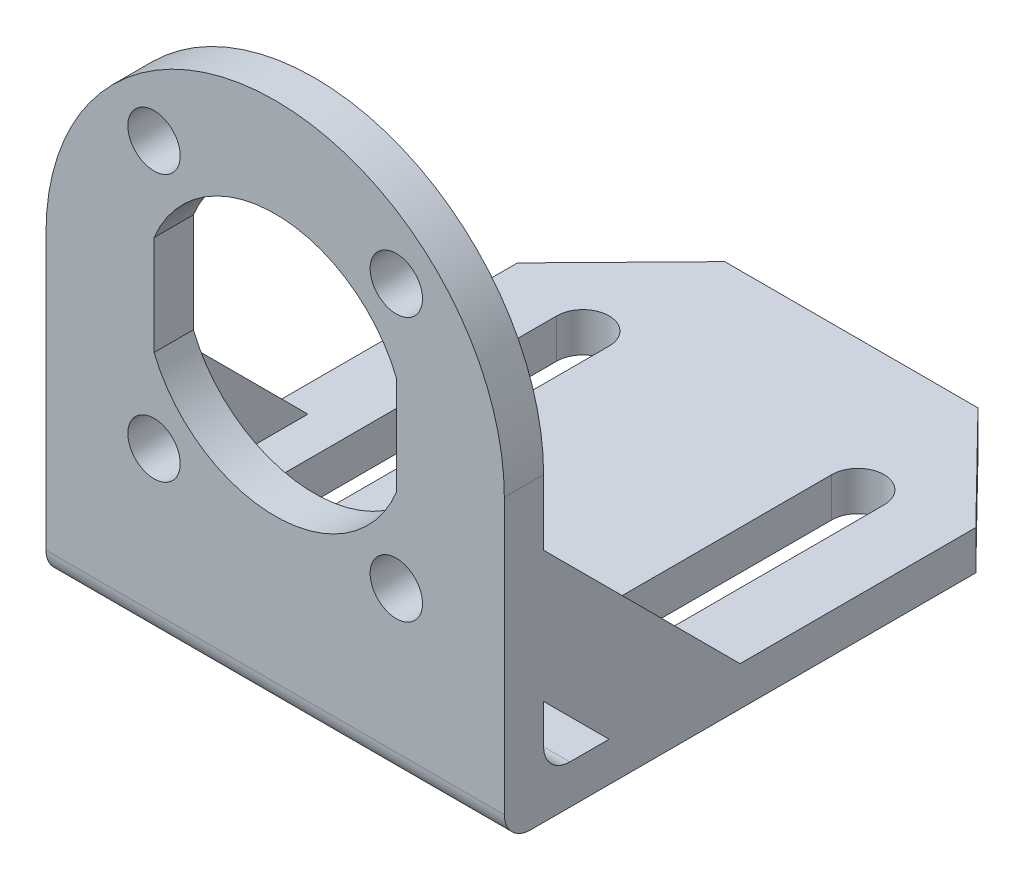
from build123d import *

# Parameters (mm, degrees)
SKETCH1_R           = 2
BOSS_EXTRUDE3_DEPTH = 1.5
SKETCH5_W           = 35
SKETCH5_H           = 3
BOSS_EXTRUDE4_DEPTH = 44
BOSS_EXTRUDE5_DEPTH = 2
CUT_EXTRUDE1_DEPTH  = 67.614562972
FILLET1_R           = 2


with BuildPart() as part:
    # Sketch1 → Boss-Extrude3 (new, symmetric)
    with BuildSketch(Plane.XY):
        with BuildLine():
            Line((0, 0), (35, 0))
            Line((35, 0), (35, 20))
            ThreePointArc((35, 20), (17.5, 37.5), (0, 20))
            Line((0, 20), (0, 0))
        make_face()
        with Locations((8.249962615, 30.201823455)):
            Circle(SKETCH1_R, mode=Mode.SUBTRACT)
        with Locations((26.75, 30)):
            Circle(SKETCH1_R, mode=Mode.SUBTRACT)
        with Locations((8.25, 9.85)):
            Circle(SKETCH1_R, mode=Mode.SUBTRACT)
        with Locations((26.75, 9.85)):
            Circle(SKETCH1_R, mode=Mode.SUBTRACT)
        with BuildLine():
            Line((8.25, 23.799671038), (8.25, 16.200328962))
            ThreePointArc((8.25, 16.200328962), (17.5, 10), (26.75, 16.200328962))
            Line((26.75, 16.200328962), (26.75, 23.799671038))
            ThreePointArc((26.75, 23.799671038), (17.5, 30), (8.25, 23.799671038))
        make_face(mode=Mode.SUBTRACT)
    extrude(amount=BOSS_EXTRUDE3_DEPTH, both=True)

    # Sketch5 → Boss-Extrude4 (add)
    with BuildSketch(Plane.XY.offset(1.5)):
        with Locations((17.5, -1.5)):
            Rectangle(SKETCH5_W, SKETCH5_H)
    extrude(amount=-BOSS_EXTRUDE4_DEPTH)

    # Sketch6 → Boss-Extrude5 (add)
    with BuildSketch(Plane(origin=(35, 0, 0), x_dir=(0, 0, -1), z_dir=(1, 0, 0))):
        Polygon((1.5, 15), (1.5, 5), (6.5, 0), (16.5, 0), align=None)
    boss_extrude5 = extrude(amount=-BOSS_EXTRUDE5_DEPTH)

    # Mirror1: Boss-Extrude5 across plane
    add(boss_extrude5.mirror(Plane(origin=(17.5, 0, 0), x_dir=(0, 0, 1), z_dir=(1, 0, 0))))

    # Sketch7 → Cut-Extrude1 (cut, through all)
    with BuildSketch(Plane(origin=(0, 0, 0), x_dir=(1, 0, 0), z_dir=(0, 1, 0))):
        with BuildLine():
            Line((5, 32.5), (5, 10.5))
            ThreePointArc((5, 10.5), (7, 8.5), (9, 10.5))
            Line((9, 10.5), (9, 32.5))
            ThreePointArc((9, 32.5), (7, 34.5), (5, 32.5))
        make_face()
        with BuildLine():
            Line((26, 32.5), (26, 10.5))
            ThreePointArc((26, 10.5), (28, 8.5), (30, 10.5))
            Line((30, 10.5), (30, 32.5))
            ThreePointArc((30, 32.5), (28, 34.5), (26, 32.5))
        make_face()
        Polygon((35, 42.5), (27.17, 42.5), (35, 34.5), align=None)
        Polygon((0, 42.5), (0, 34.5), (7.83, 42.5), align=None)
    extrude(amount=-CUT_EXTRUDE1_DEPTH, mode=Mode.SUBTRACT)

    # Fillet1
    fillet1_edges = [part.edges().sort_by_distance(p)[0] for p in [
        (17.5, -3, 1.5),
        (17.5, 0, -1.5),
    ]]
    fillet(fillet1_edges, radius=FILLET1_R)


solid = part.part
